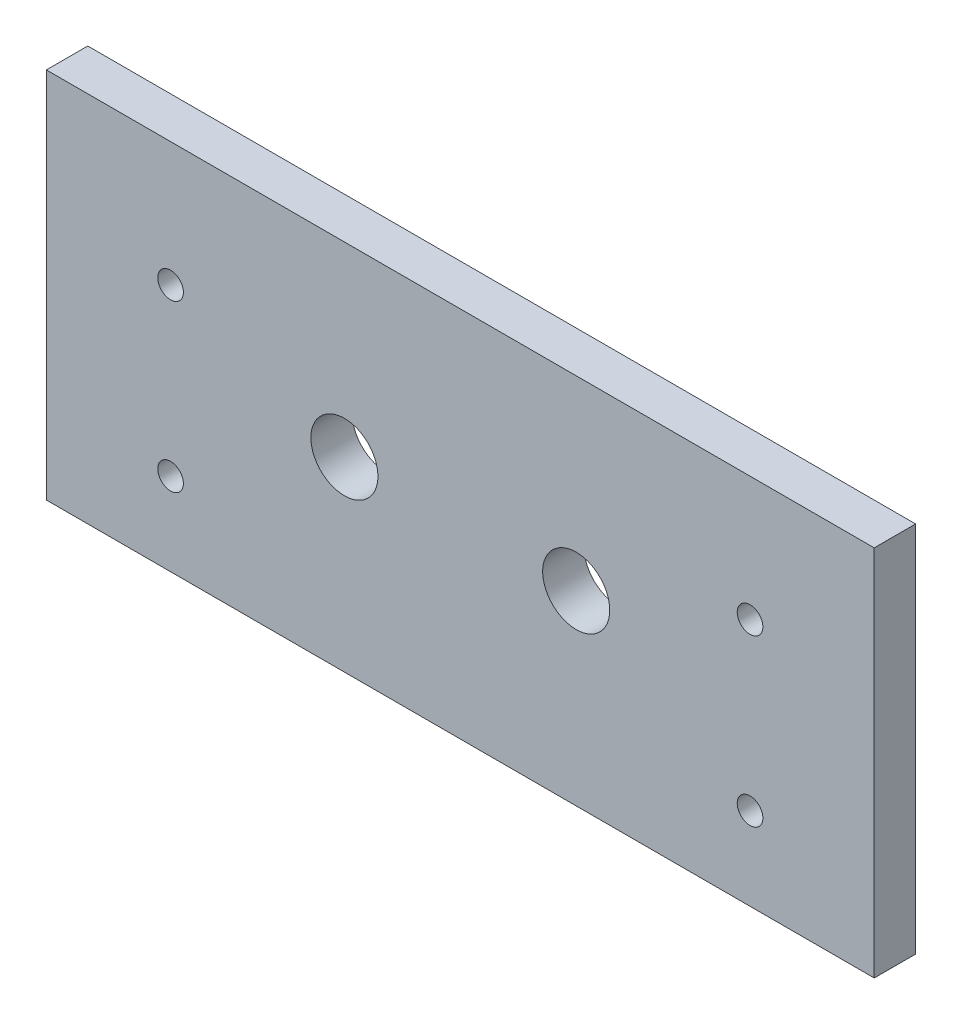
from build123d import *

# Parameters (mm, degrees)
ESQUISSE1_W        = 100
ESQUISSE1_H        = 45
ESQUISSE1_R        = 1.55
ESQUISSE1_R_2      = 4.05
BOSS_EXTRU_1_DEPTH = 5


with BuildPart() as part:
    # Esquisse1 → Boss.-Extru.1 (new body)
    with BuildSketch(Plane.XY):
        Rectangle(ESQUISSE1_W, ESQUISSE1_H)
        with Locations((-35, -12.5)):
            Circle(ESQUISSE1_R, mode=Mode.SUBTRACT)
        with Locations(Location((35, -12.5, 0), (0, 0, 180))):
            Circle(ESQUISSE1_R, mode=Mode.SUBTRACT)
        with Locations((14, 0)):
            Circle(ESQUISSE1_R_2, mode=Mode.SUBTRACT)
        with Locations(Location((-14, 0, 0), (0, 0, 180))):
            Circle(ESQUISSE1_R_2, mode=Mode.SUBTRACT)
        with Locations((-35, 7.5)):
            Circle(ESQUISSE1_R, mode=Mode.SUBTRACT)
        with Locations(Location((35, 7.5, 0), (0, 0, 180))):
            Circle(ESQUISSE1_R, mode=Mode.SUBTRACT)
    extrude(amount=-BOSS_EXTRU_1_DEPTH)


solid = part.part
